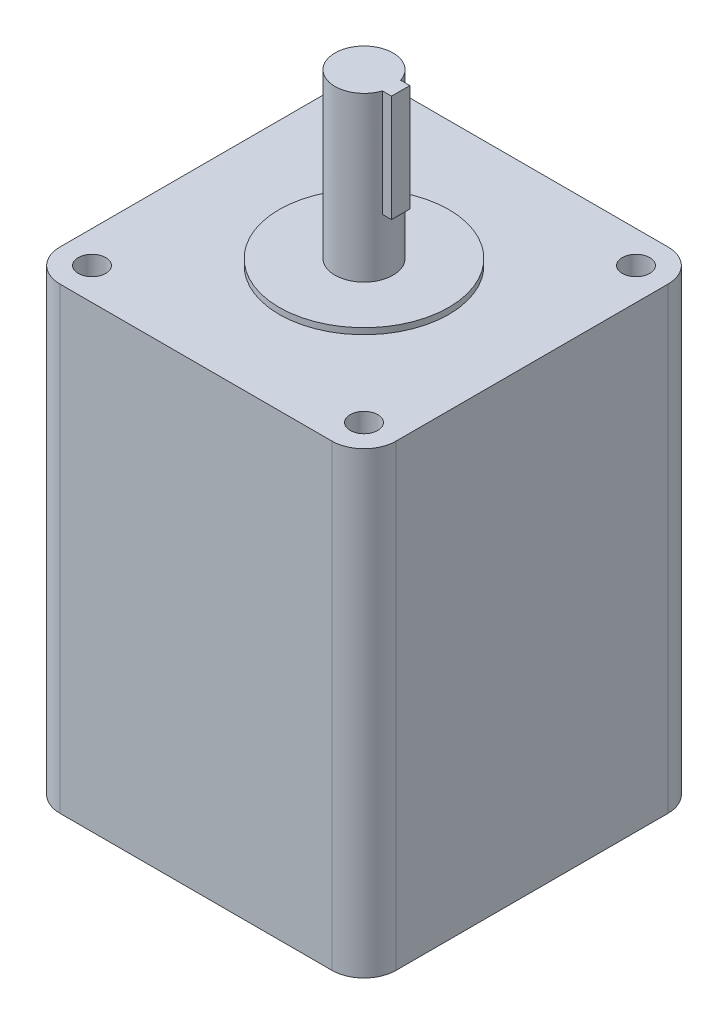
from build123d import *

# Parameters (mm, degrees)
BOSS_EXTRUDE1_DEPTH = 150
SKETCH2_R           = 4.5
CUT_EXTRUDE2_DEPTH  = 12.5
SKETCH3_R           = 9.5
BOSS_EXTRUDE2_DEPTH = 55.5
SKETCH4_R           = 27.75
BOSS_EXTRUDE3_DEPTH = 2
SKETCH5_W           = 6
SKETCH5_H           = 35
BOSS_EXTRUDE4_DEPTH = 12


with BuildPart() as part:
    # Sketch1 → Boss-Extrude1 (new body)
    with BuildSketch(Plane(origin=(0, 0, 0), x_dir=(1, 0, 0), z_dir=(0, 1, 0))):
        with BuildLine():
            Line((-44.5, 55), (44.5, 55))
            ThreePointArc((44.5, 55), (51.924621202, 51.924621202), (55, 44.5))
            Line((55, 44.5), (55, -44.5))
            ThreePointArc((55, -44.5), (51.924621202, -51.924621202), (44.5, -55))
            Line((44.5, -55), (-44.5, -55))
            ThreePointArc((-44.5, -55), (-51.924621202, -51.924621202), (-55, -44.5))
            Line((-55, -44.5), (-55, 44.5))
            ThreePointArc((-55, 44.5), (-51.924621202, 51.924621202), (-44.5, 55))
        make_face()
    extrude(amount=BOSS_EXTRUDE1_DEPTH)

    # Sketch2 → Cut-Extrude2 (cut)
    with BuildSketch(Plane(origin=(0, 150, 0), x_dir=(1, 0, 0), z_dir=(0, 1, 0))):
        with Locations(Location((-44.5, 44.5, 0), (0, 0, 270))):
            Circle(SKETCH2_R)
        with Locations(Location((44.5, 44.5, 0), (0, 0, 270))):
            Circle(SKETCH2_R)
        with Locations(Location((-44.5, -44.5, 0), (0, 0, 270))):
            Circle(SKETCH2_R)
        with Locations(Location((44.5, -44.5, 0), (0, 0, 270))):
            Circle(SKETCH2_R)
    extrude(amount=-CUT_EXTRUDE2_DEPTH, mode=Mode.SUBTRACT)

    # Sketch3 → Boss-Extrude2 (add)
    with BuildSketch(Plane(origin=(0, 150, 0), x_dir=(1, 0, 0), z_dir=(0, 1, 0))):
        with Locations(Location((0, 0, 0), (0, 0, 270))):
            Circle(SKETCH3_R)
    extrude(amount=BOSS_EXTRUDE2_DEPTH)

    # Sketch4 → Boss-Extrude3 (add)
    with BuildSketch(Plane(origin=(0, 150, 0), x_dir=(1, 0, 0), z_dir=(0, 1, 0))):
        with Locations(Location((0, 0, 0), (0, 0, 270))):
            Circle(SKETCH4_R)
    extrude(amount=BOSS_EXTRUDE3_DEPTH)

    # Sketch5 → Boss-Extrude4 (add)
    with BuildSketch(Plane(origin=(0, 0, 0), x_dir=(0, 0, -1), z_dir=(1, 0, 0))):
        with Locations((0, 188)):
            Rectangle(SKETCH5_W, SKETCH5_H)
    extrude(amount=BOSS_EXTRUDE4_DEPTH)


solid = part.part
